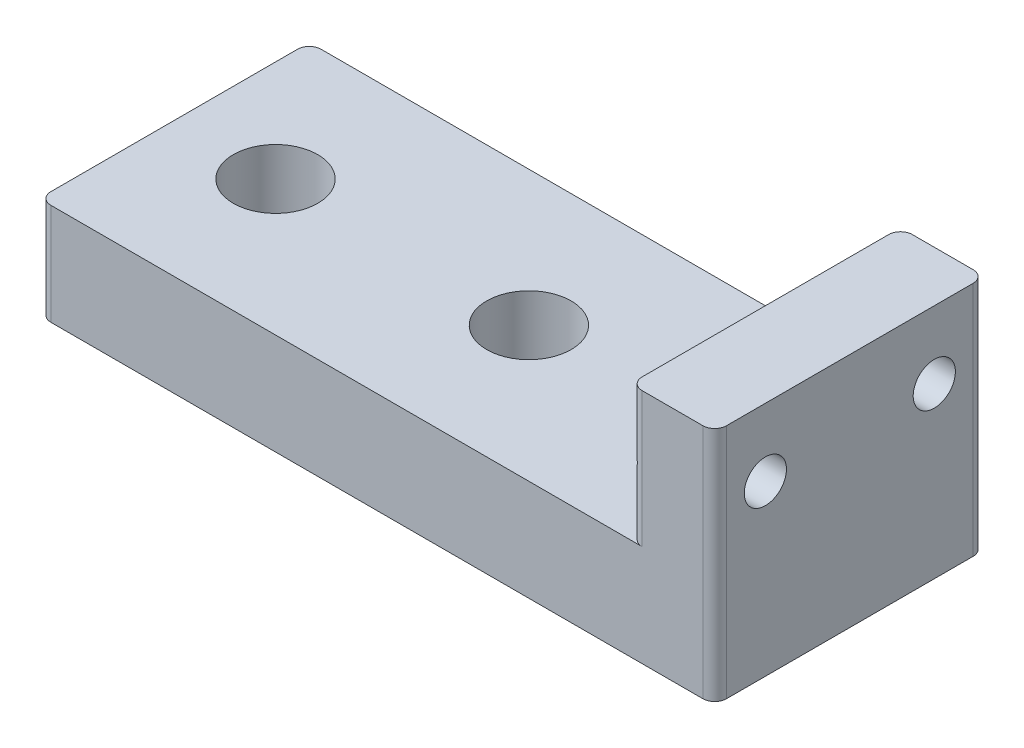
from build123d import *

# Parameters (mm, degrees)
SKETCH1_W           = 40
SKETCH1_H           = 16
BOSS_EXTRUDE1_DEPTH = 6
SKETCH1_4_W         = 5
SKETCH1_4_H         = 16
BOSS_EXTRUDE2_DEPTH = 14
SKETCH4_R           = 2.5
CUT_EXTRUDE1_DEPTH  = 14
SKETCH3_R           = 1.25
CUT_EXTRUDE2_DEPTH  = 14
FILLET1_R           = 0.7
CUT_EXTRUDE3_DEPTH  = 3


with BuildPart() as part:
    # Sketch1 → Boss-Extrude1 (new body)
    with BuildSketch(Plane(origin=(0, 0, 0), x_dir=(1, 0, 0), z_dir=(0, 1, 0))):
        with Locations((20, 8)):
            Rectangle(SKETCH1_W, SKETCH1_H)
    extrude(amount=BOSS_EXTRUDE1_DEPTH)

    # Sketch1<4> → Boss-Extrude2 (add)
    with BuildSketch(Plane(origin=(0, 0, 0), x_dir=(1, 0, 0), z_dir=(0, 1, 0))):
        with Locations((37.5, 8)):
            Rectangle(SKETCH1_4_W, SKETCH1_4_H)
    extrude(amount=BOSS_EXTRUDE2_DEPTH)

    # Sketch4 → Cut-Extrude1 (cut)
    with BuildSketch(Plane(origin=(0, 6, 0), x_dir=(1, 0, 0), z_dir=(0, 1, 0))):
        with Locations((6, 8)):
            Circle(SKETCH4_R)
        with Locations((21, 8)):
            Circle(SKETCH4_R)
    extrude(amount=-CUT_EXTRUDE1_DEPTH, mode=Mode.SUBTRACT)

    # Sketch3 → Cut-Extrude2 (cut)
    with BuildSketch(Plane.ZY.offset(-35)):
        with Locations((-13, 10)):
            Circle(SKETCH3_R)
        with Locations((-3, 10)):
            Circle(SKETCH3_R)
    extrude(amount=-CUT_EXTRUDE2_DEPTH, mode=Mode.SUBTRACT)

    # Fillet1
    fillet1_edges = [part.edges().sort_by_distance(p)[0] for p in [
        (0, 3, -16),
        (0, 3, 0),
        (35, 10, -16),
        (40, 7, -16),
        (35, 10, 0),
        (40, 7, 0),
    ]]
    fillet(fillet1_edges, radius=FILLET1_R)

    # Sketch5 → Cut-Extrude3 (cut)
    with BuildSketch(Plane.ZY.offset(-35)):
        Polygon((-11.556624327, 12.5), (-14.443375673, 12.5), (-15.886751346, 10), (-14.443375673, 7.5), (-11.556624327, 7.5), (-10.113248654, 10), align=None)
        Polygon((-4.443375673, 12.5), (-5.886751346, 10), (-4.443375673, 7.5), (-1.556624327, 7.5), (-0.113248654, 10), (-1.556624327, 12.5), align=None)
    extrude(amount=-CUT_EXTRUDE3_DEPTH, mode=Mode.SUBTRACT)


solid = part.part
